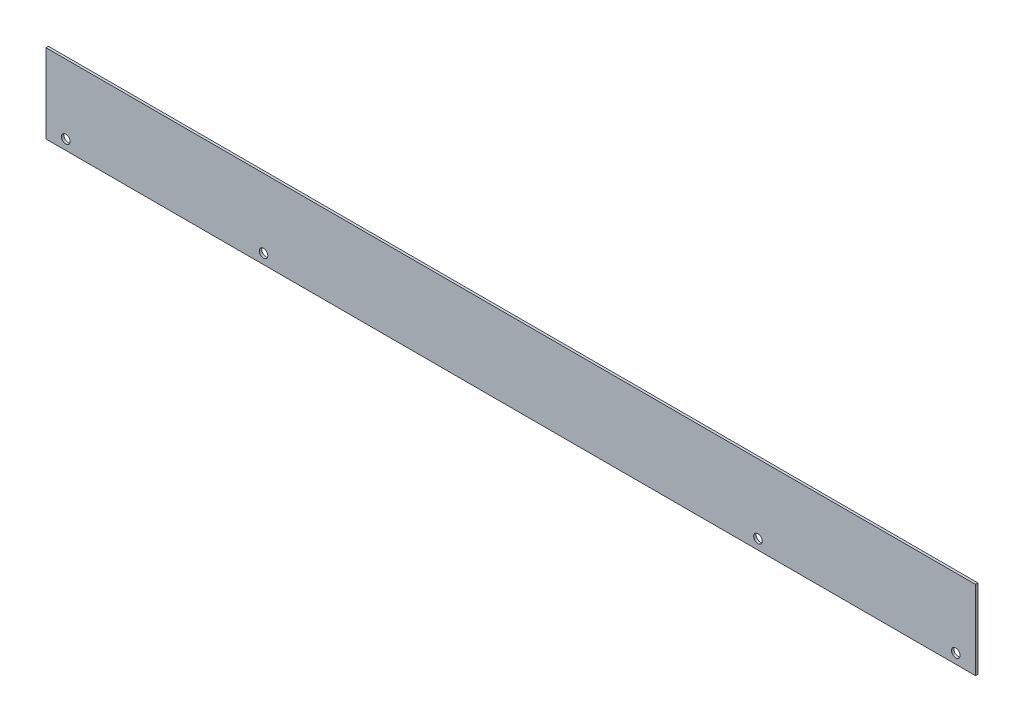
from build123d import *

# Parameters (mm, degrees)
SKETCH2_W            = 596.9
SKETCH2_H            = 50.8
BOSS_EXTRUDE1_DEPTH  = 1.5875
M5_CLEARANCE_HOLE1_D = 5.5


with BuildPart() as part:
    # Sketch2 → Boss-Extrude1 (new body)
    with BuildSketch(Plane.XY):
        with Locations((298.45, 25.4)):
            Rectangle(SKETCH2_W, SKETCH2_H)
    extrude(amount=BOSS_EXTRUDE1_DEPTH)

    # M5 Clearance Hole1 (through all)
    with Locations(Plane.XY.offset(1.5875)):
        with Locations((584.2, 6.35), (457.2, 6.35), (139.7, 6.35), (12.7, 6.35)):
            Hole(M5_CLEARANCE_HOLE1_D / 2)


solid = part.part
